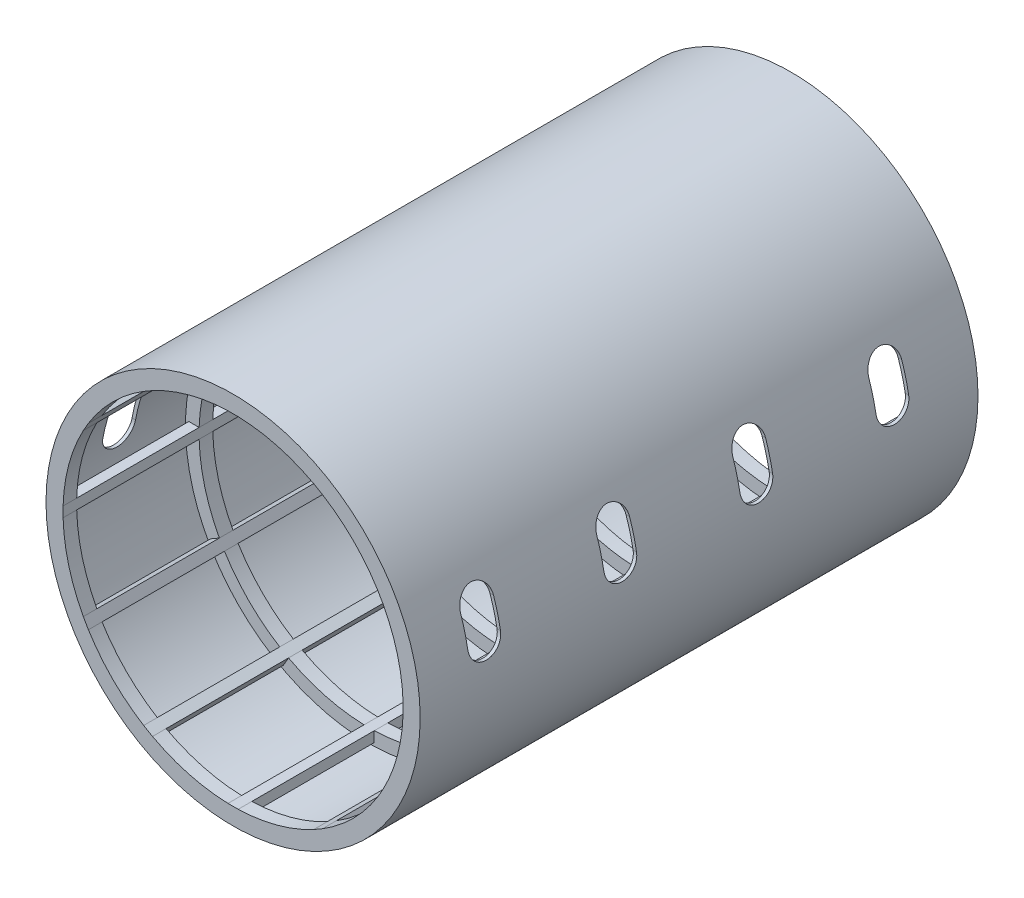
from build123d import *

# Parameters (mm, degrees)
SKETCH2_R           = 27
SKETCH2_R_2         = 25
BOSS_EXTRUDE1_DEPTH = 2
SKETCH3_W           = 1.5
SKETCH3_H           = 3
SKETCH3_W_2         = 3
SKETCH3_H_2         = 1.5
CUT_EXTRUDE1_DEPTH  = 25
LPATTERN4_COUNT     = 5
LPATTERN4_PITCH     = 20
SKETCH4_R           = 27.5
SKETCH4_R_2         = 27
BOSS_EXTRUDE2_DEPTH = 82
BOSS_EXTRUDE3_DEPTH = 82
SKETCH7_W           = 1.5
SKETCH7_H           = 1.511252532
SKETCH7_W_2         = 1.511252532
SKETCH7_H_2         = 1.5
BOSS_EXTRUDE4_DEPTH = 82
CUT_EXTRUDE4_DEPTH  = 35


with BuildPart() as part:
    # Sketch2 → Boss-Extrude1 (new body)
    with BuildSketch(Plane.XY):
        Circle(SKETCH2_R)
        Circle(SKETCH2_R_2, mode=Mode.SUBTRACT)
    extrude(amount=BOSS_EXTRUDE1_DEPTH)

    # Sketch3 → Cut-Extrude1 (cut)
    with BuildSketch(Plane.XY.offset(2)):
        Polygon((12.600480947, 23.3246732), (11.100480947, 20.726596989), (12.399519053, 19.976596989), (13.899519053, 22.5746732), align=None)
        with Locations((0, 25)):
            Rectangle(SKETCH3_W, SKETCH3_H)
        Polygon((22.5746732, 13.899519053), (19.976596989, 12.399519053), (20.726596989, 11.100480947), (23.3246732, 12.600480947), align=None)
        with Locations((25, 0)):
            Rectangle(SKETCH3_W_2, SKETCH3_H_2)
        Polygon((23.3246732, -12.600480947), (20.726596989, -11.100480947), (19.976596989, -12.399519053), (22.5746732, -13.899519053), align=None)
        Polygon((13.899519053, -22.5746732), (12.399519053, -19.976596989), (11.100480947, -20.726596989), (12.600480947, -23.3246732), align=None)
        with Locations((0, -25)):
            Rectangle(SKETCH3_W, SKETCH3_H)
        Polygon((-12.600480947, -23.3246732), (-11.100480947, -20.726596989), (-12.399519053, -19.976596989), (-13.899519053, -22.5746732), align=None)
        Polygon((-22.5746732, -13.899519053), (-19.976596989, -12.399519053), (-20.726596989, -11.100480947), (-23.3246732, -12.600480947), align=None)
        with Locations((-25, 0)):
            Rectangle(SKETCH3_W_2, SKETCH3_H_2)
        Polygon((-23.3246732, 12.600480947), (-20.726596989, 11.100480947), (-19.976596989, 12.399519053), (-22.5746732, 13.899519053), align=None)
        Polygon((-13.899519053, 22.5746732), (-12.399519053, 19.976596989), (-11.100480947, 20.726596989), (-12.600480947, 23.3246732), align=None)
    extrude(amount=-CUT_EXTRUDE1_DEPTH, mode=Mode.SUBTRACT)


with BuildPart() as lpattern4_1:
    # LPattern4: pattern copy
    add(part.part.moved(Location(Vector(0, 0, 1) * (1 * LPATTERN4_PITCH))))


with BuildPart() as lpattern4_2:
    # LPattern4: pattern copy
    add(part.part.moved(Location(Vector(0, 0, 1) * (2 * LPATTERN4_PITCH))))


with BuildPart() as lpattern4_3:
    # LPattern4: pattern copy
    add(part.part.moved(Location(Vector(0, 0, 1) * (3 * LPATTERN4_PITCH))))


with BuildPart() as lpattern4_4:
    # LPattern4: pattern copy
    add(part.part.moved(Location(Vector(0, 0, 1) * (4 * LPATTERN4_PITCH))))


with BuildPart() as part_1:
    add(part.part)

    add(lpattern4_1.part)  # Boss-Extrude2 merges LPattern4_1

    add(lpattern4_2.part)  # Boss-Extrude2 merges LPattern4_2

    add(lpattern4_3.part)  # Boss-Extrude2 merges LPattern4_3

    add(lpattern4_4.part)  # Boss-Extrude2 merges LPattern4_4
    # Sketch4 → Boss-Extrude2 (add)
    with BuildSketch(Plane(origin=(0, 0, 0), x_dir=(-1, 0, 0), z_dir=(0, 0, -1))):
        Circle(SKETCH4_R)
        Circle(SKETCH4_R_2, mode=Mode.SUBTRACT)
    extrude(amount=-BOSS_EXTRUDE2_DEPTH)

    # Sketch6 → Boss-Extrude3 (add, through all)
    with BuildSketch(Plane.XY.offset(82)):
        Polygon((-13.899519053, 22.5746732), (-12.600480947, 23.3246732), (-11.844854681, 22.015890116), (-13.143892787, 21.265890116), align=None)
    extrude(amount=-BOSS_EXTRUDE3_DEPTH)

    # Sketch7 → Boss-Extrude4 (add, through all)
    with BuildSketch(Plane.XY.offset(82)):
        with Locations((0, 25.744373734)):
            Rectangle(SKETCH7_W, SKETCH7_H)
        Polygon((11.844854681, 22.015890116), (12.600480947, 23.3246732), (13.899519053, 22.5746732), (13.143892787, 21.265890116), align=None)
        Polygon((21.265890116, 13.143892787), (22.5746732, 13.899519053), (23.3246732, 12.600480947), (22.015890116, 11.844854681), align=None)
        with Locations((25.744373734, 0)):
            Rectangle(SKETCH7_W_2, SKETCH7_H_2)
        Polygon((21.265890116, -13.143892787), (22.015890116, -11.844854681), (23.3246732, -12.600480947), (22.5746732, -13.899519053), align=None)
        Polygon((11.844854681, -22.015890116), (13.143892787, -21.265890116), (13.899519053, -22.5746732), (12.600480947, -23.3246732), align=None)
        with Locations((0, -25.744373734)):
            Rectangle(SKETCH7_W, SKETCH7_H)
        Polygon((-13.143892787, -21.265890116), (-11.844854681, -22.015890116), (-12.600480947, -23.3246732), (-13.899519053, -22.5746732), align=None)
        Polygon((-23.3246732, -12.600480947), (-22.015890116, -11.844854681), (-21.265890116, -13.143892787), (-22.5746732, -13.899519053), align=None)
        with Locations((-25.744373734, 0)):
            Rectangle(SKETCH7_W_2, SKETCH7_H_2)
        Polygon((-23.3246732, 12.600480947), (-22.5746732, 13.899519053), (-21.265890116, 13.143892787), (-22.015890116, 11.844854681), align=None)
    extrude(amount=-BOSS_EXTRUDE4_DEPTH)

    # Sketch5 → Cut-Extrude4 (cut, symmetric)
    with BuildSketch(Plane(origin=(0, 0, 0), x_dir=(0, 0, -1), z_dir=(1, 0, 0))):
        with BuildLine():
            Line((-69.770502665, 8.811120847), (-69.770502665, 4.811120847))
            ThreePointArc((-69.770502665, 4.811120847), (-72.176063089, 2.405560424), (-74.581623512, 4.811120847))
            Line((-74.581623512, 4.811120847), (-74.581623512, 8.811120847))
            ThreePointArc((-74.581623512, 8.811120847), (-72.176063089, 11.216681271), (-69.770502665, 8.811120847))
        make_face()
        with BuildLine():
            Line((-54.581623512, 8.811120847), (-54.581623512, 4.811120847))
            ThreePointArc((-54.581623512, 4.811120847), (-52.176063089, 2.405560424), (-49.770502665, 4.811120847))
            Line((-49.770502665, 4.811120847), (-49.770502665, 8.811120847))
            ThreePointArc((-49.770502665, 8.811120847), (-52.176063089, 11.216681271), (-54.581623512, 8.811120847))
        make_face()
        with BuildLine():
            Line((-34.581623512, 8.811120847), (-34.581623512, 4.811120847))
            ThreePointArc((-34.581623512, 4.811120847), (-32.176063089, 2.405560424), (-29.770502665, 4.811120847))
            Line((-29.770502665, 4.811120847), (-29.770502665, 8.811120847))
            ThreePointArc((-29.770502665, 8.811120847), (-32.176063089, 11.216681271), (-34.581623512, 8.811120847))
        make_face()
        with BuildLine():
            Line((-14.581623512, 8.811120847), (-14.581623512, 4.811120847))
            ThreePointArc((-14.581623512, 4.811120847), (-12.176063089, 2.405560424), (-9.770502665, 4.811120847))
            Line((-9.770502665, 4.811120847), (-9.770502665, 8.811120847))
            ThreePointArc((-9.770502665, 8.811120847), (-12.176063089, 11.216681271), (-14.581623512, 8.811120847))
        make_face()
    extrude(amount=CUT_EXTRUDE4_DEPTH, both=True, mode=Mode.SUBTRACT)


solid = part_1.part
